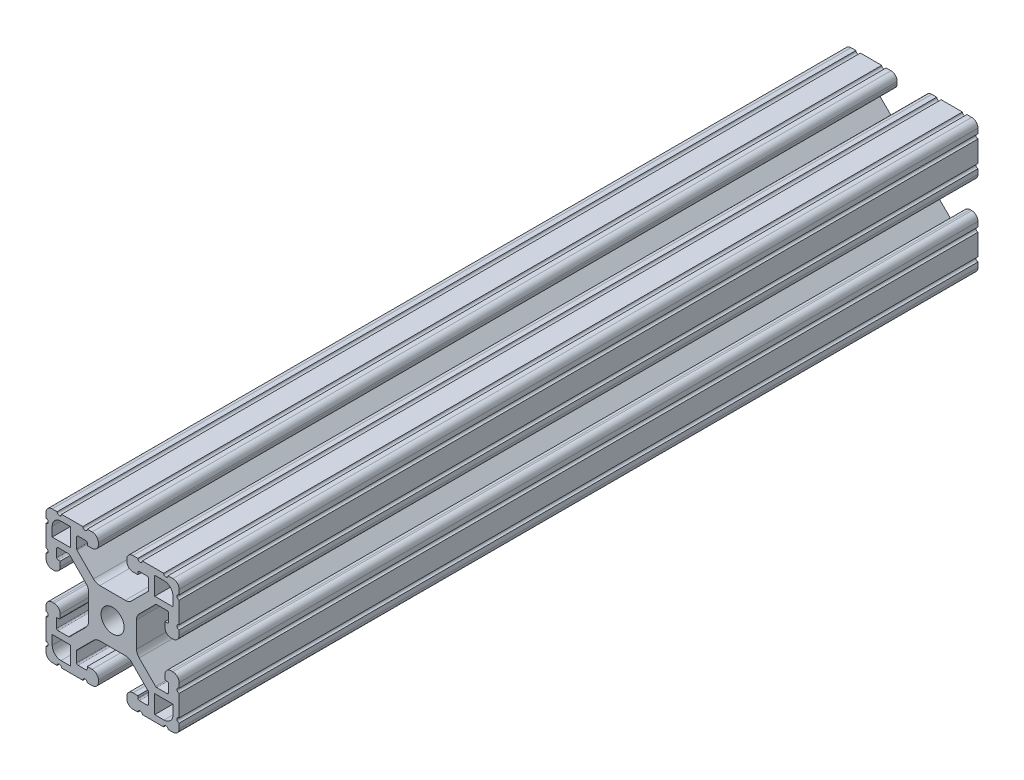
from build123d import *

# Parameters (mm, degrees)
BOSS_EXTRUDE1_DEPTH      = 114.3
BOSS_EXTRUDE1_DEPTH_BACK = 114.3
SKETCH3_W                = 38.1
SKETCH3_H                = 38.1
SKETCH4_W                = 5.207
SKETCH4_H                = 5.207
SKETCH4_R                = 3.302
CUT_EXTRUDE1_DEPTH       = 231.182025797
CUT_EXTRUDE2_DEPTH       = 231.182025797
FILLET1_R                = 2.54
FILLET2_R                = 1.778
FILLET3_R                = 0.396875


with BuildPart() as part:
    # Sketch3 → Boss-Extrude1 (new, two sides: drawn at the far end of the back side and taken through both)
    with BuildSketch(Plane.XY.offset(-BOSS_EXTRUDE1_DEPTH_BACK)):
        Rectangle(SKETCH3_W, SKETCH3_H)
    extrude(amount=BOSS_EXTRUDE1_DEPTH + BOSS_EXTRUDE1_DEPTH_BACK)

    # Sketch4 → Cut-Extrude1 (cut, through all)
    with BuildSketch(Plane.XY.offset(114.3)):
        Polygon((7.239, 14.986), (4.064, 14.986), (4.064, 19.05), (-4.064, 19.05), (-4.064, 14.986), (-7.239, 14.986), (-7.239, 16.002), (-10.287, 16.002), (-10.287, 12.442261469), (-4.702738531, 6.858), (4.702738531, 6.858), (10.287, 12.442261469), (10.287, 16.002), (7.239, 16.002), align=None)
        Polygon((10.287, -12.442261469), (4.702738531, -6.858), (-4.702738531, -6.858), (-10.287, -12.442261469), (-10.287, -16.002), (-7.239, -16.002), (-7.239, -14.986), (-4.064, -14.986), (-4.064, -19.05), (4.064, -19.05), (4.064, -14.986), (7.239, -14.986), (7.239, -16.002), (10.287, -16.002), align=None)
        Polygon((-12.442261469, -10.287), (-6.858, -4.702738531), (-6.858, 4.702738531), (-12.442261469, 10.287), (-16.002, 10.287), (-16.002, 7.239), (-14.986, 7.239), (-14.986, 4.064), (-19.05, 4.064), (-19.05, -4.064), (-14.986, -4.064), (-14.986, -7.239), (-16.002, -7.239), (-16.002, -10.287), align=None)
        Polygon((14.986, -7.239), (14.986, -4.064), (19.05, -4.064), (19.05, 4.064), (14.986, 4.064), (14.986, 7.239), (16.002, 7.239), (16.002, 10.287), (12.442261469, 10.287), (6.858, 4.702738531), (6.858, -4.702738531), (12.442261469, -10.287), (16.002, -10.287), (16.002, -7.239), align=None)
        with Locations((14.6685, 14.6685)):
            Rectangle(SKETCH4_W, SKETCH4_H)
        with Locations((14.6685, -14.6685)):
            Rectangle(SKETCH4_W, SKETCH4_H)
        with Locations((-14.6685, 14.6685)):
            Rectangle(SKETCH4_W, SKETCH4_H)
        with Locations((-14.6685, -14.6685)):
            Rectangle(SKETCH4_W, SKETCH4_H)
        Circle(SKETCH4_R)
    extrude(amount=-CUT_EXTRUDE1_DEPTH, mode=Mode.SUBTRACT)

    # Sketch5 → Cut-Extrude2 (cut, through all)
    with BuildSketch(Plane.XY.offset(114.3)):
        with BuildLine():
            Line((-14.605, 19.05), (-15.875, 19.05))
            ThreePointArc((-15.875, 19.05), (-15.24, 18.415), (-14.605, 19.05))
        make_face()
        with BuildLine():
            Line((-7.239, 19.05), (-8.509, 19.05))
            ThreePointArc((-8.509, 19.05), (-7.874, 18.415), (-7.239, 19.05))
        make_face()
        with BuildLine():
            ThreePointArc((-19.05, 14.605), (-18.415, 15.24), (-19.05, 15.875))
            Line((-19.05, 15.875), (-19.05, 14.605))
        make_face()
        with BuildLine():
            ThreePointArc((-19.05, 7.239), (-18.415, 7.874), (-19.05, 8.509))
            Line((-19.05, 8.509), (-19.05, 7.239))
        make_face()
        with BuildLine():
            ThreePointArc((7.239, 19.05), (7.874, 18.415), (8.509, 19.05))
            Line((8.509, 19.05), (7.239, 19.05))
        make_face()
        with BuildLine():
            ThreePointArc((14.605, 19.05), (15.24, 18.415), (15.875, 19.05))
            Line((15.875, 19.05), (14.605, 19.05))
        make_face()
        with BuildLine():
            Line((19.05, 14.605), (19.05, 15.875))
            ThreePointArc((19.05, 15.875), (18.415, 15.24), (19.05, 14.605))
        make_face()
        with BuildLine():
            Line((19.05, 7.239), (19.05, 8.509))
            ThreePointArc((19.05, 8.509), (18.415, 7.874), (19.05, 7.239))
        make_face()
        with BuildLine():
            ThreePointArc((19.05, -7.239), (18.415, -7.874), (19.05, -8.509))
            Line((19.05, -8.509), (19.05, -7.239))
        make_face()
        with BuildLine():
            ThreePointArc((19.05, -14.605), (18.415, -15.24), (19.05, -15.875))
            Line((19.05, -15.875), (19.05, -14.605))
        make_face()
        with BuildLine():
            Line((14.605, -19.05), (15.875, -19.05))
            ThreePointArc((15.875, -19.05), (15.24, -18.415), (14.605, -19.05))
        make_face()
        with BuildLine():
            Line((7.239, -19.05), (8.509, -19.05))
            ThreePointArc((8.509, -19.05), (7.874, -18.415), (7.239, -19.05))
        make_face()
        with BuildLine():
            ThreePointArc((-7.239, -19.05), (-7.874, -18.415), (-8.509, -19.05))
            Line((-8.509, -19.05), (-7.239, -19.05))
        make_face()
        with BuildLine():
            ThreePointArc((-14.605, -19.05), (-15.24, -18.415), (-15.875, -19.05))
            Line((-15.875, -19.05), (-14.605, -19.05))
        make_face()
        with BuildLine():
            Line((-19.05, -14.605), (-19.05, -15.875))
            ThreePointArc((-19.05, -15.875), (-18.415, -15.24), (-19.05, -14.605))
        make_face()
        with BuildLine():
            Line((-19.05, -7.239), (-19.05, -8.509))
            ThreePointArc((-19.05, -8.509), (-18.415, -7.874), (-19.05, -7.239))
        make_face()
    extrude(amount=-CUT_EXTRUDE2_DEPTH, mode=Mode.SUBTRACT)

    # Fillet1
    fillet1_edges = [part.edges().sort_by_distance(p)[0] for p in [
        (6.858, -4.702738531, 0),
        (6.858, 4.702738531, 0),
        (-17.272, 17.272, 0),
        (-17.272, -17.272, 0),
        (17.272, -17.272, 0),
        (17.272, 17.272, 0),
        (-4.702738531, -6.858, 0),
        (4.702738531, -6.858, 0),
        (-6.858, 4.702738531, 0),
        (-6.858, -4.702738531, 0),
        (4.702738531, 6.858, 0),
        (-4.702738531, 6.858, 0),
    ]]
    fillet(fillet1_edges, radius=FILLET1_R)

    # Fillet2
    fillet2_edges = [part.edges().sort_by_distance(p)[0] for p in [
        (14.986, 4.064, 0),
        (19.05, 4.064, 0),
        (19.05, -4.064, 0),
        (14.986, -4.064, 0),
        (4.064, -14.986, 0),
        (4.064, -19.05, 0),
        (-4.064, -19.05, 0),
        (-4.064, -14.986, 0),
        (-14.986, -4.064, 0),
        (-19.05, -4.064, 0),
        (-19.05, 4.064, 0),
        (-14.986, 4.064, 0),
        (-19.05, 19.05, 0),
        (19.05, 19.05, 0),
        (19.05, -19.05, 0),
        (-19.05, -19.05, 0),
        (-4.064, 14.986, 0),
        (-4.064, 19.05, 0),
        (4.064, 19.05, 0),
        (4.064, 14.986, 0),
    ]]
    fillet(fillet2_edges, radius=FILLET2_R)

    # Fillet3
    fillet3_edges = [part.edges().sort_by_distance(p)[0] for p in [
        (12.442261469, 10.287, 0),
        (16.002, 10.287, 0),
        (16.002, 7.239, 0),
        (16.002, -7.239, 0),
        (16.002, -10.287, 0),
        (12.442261469, -10.287, 0),
        (-7.239, -16.002, 0),
        (-10.287, -16.002, 0),
        (-10.287, -12.442261469, 0),
        (10.287, -12.442261469, 0),
        (10.287, -16.002, 0),
        (7.239, -16.002, 0),
        (-16.002, 7.239, 0),
        (-16.002, 10.287, 0),
        (-12.442261469, 10.287, 0),
        (-12.442261469, -10.287, 0),
        (-16.002, -10.287, 0),
        (-14.986, -7.239, 0),
        (-10.287, 12.442261469, 0),
        (-10.287, 16.002, 0),
        (-7.239, 16.002, 0),
        (7.239, 16.002, 0),
        (10.287, 16.002, 0),
        (10.287, 12.442261469, 0),
    ]]
    fillet(fillet3_edges, radius=FILLET3_R)


solid = part.part
